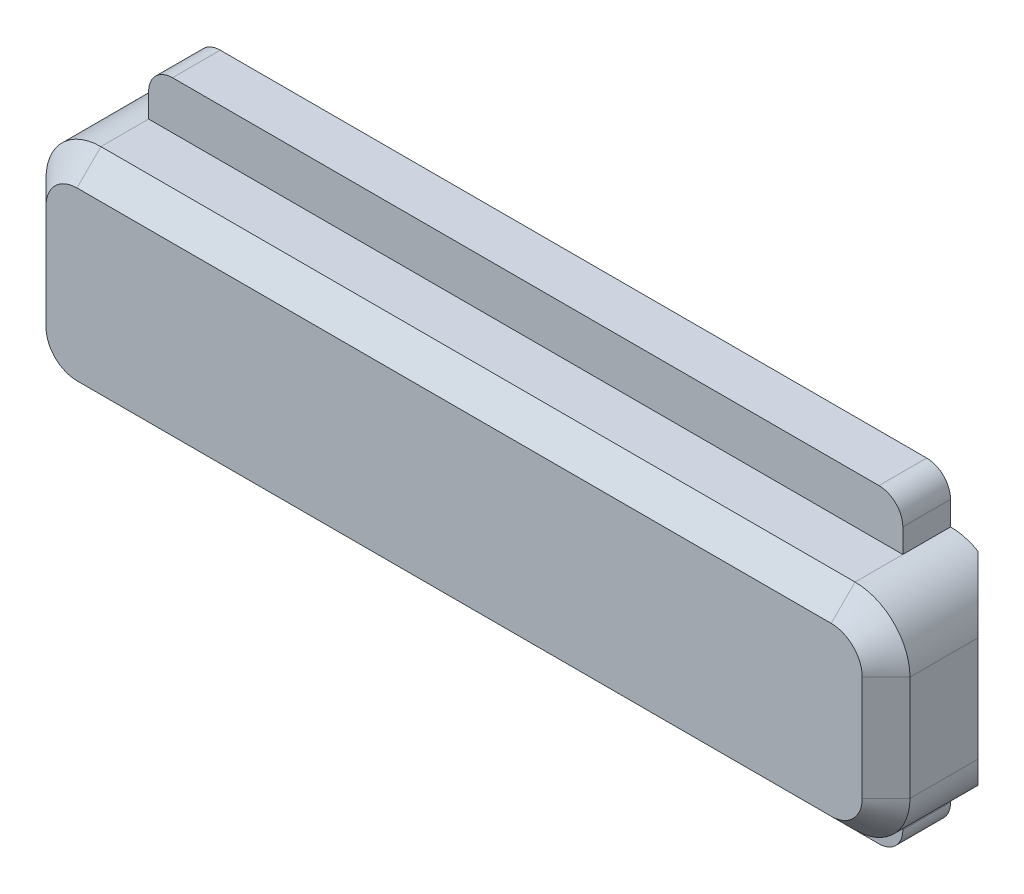
from build123d import *

# Parameters (mm, degrees)
EXTRUDE_1_DEPTH     = 2.5
SKETCH_2_W          = 15.8
SKETCH_2_H          = 6.5
EXTRUDE_2_DEPTH     = 1
FILLET_1_R          = 0.5
CHAMFER_1_SIZE      = 0.5
CUT_EXTRUDE_1_DEPTH = 12.419391402


with BuildPart() as part:
    # 草图1 → 凸台-拉伸1 (new body)
    with BuildSketch(Plane.XY):
        with BuildLine():
            Line((-9.05, -1.25), (-9.05, -3.45))
            ThreePointArc((-9.05, -3.45), (-8.713172798, -4.263172798), (-7.9, -4.6))
            Line((-7.9, -4.6), (7.9, -4.6))
            ThreePointArc((7.9, -4.6), (8.713172798, -4.263172798), (9.05, -3.45))
            Line((9.05, -3.45), (9.05, -1.25))
            ThreePointArc((9.05, -1.25), (8.713172798, -0.436827202), (7.9, -0.1))
            Line((7.9, -0.1), (-7.9, -0.1))
            ThreePointArc((-7.9, -0.1), (-8.713172798, -0.436827202), (-9.05, -1.25))
        make_face()
    extrude(amount=-EXTRUDE_1_DEPTH)

    # 草图2 → 凸台-拉伸2 (add)
    with BuildSketch(Plane(origin=(0, 0, -2.5), x_dir=(-1, 0, 0), z_dir=(0, 0, -1))):
        with Locations((0, -2.35)):
            Rectangle(SKETCH_2_W, SKETCH_2_H)
    extrude(amount=-EXTRUDE_2_DEPTH)

    # 圆角1
    fillet_1_edges = [part.edges().sort_by_distance(p)[0] for p in [
        (-7.9, 0.9, -2),
        (-7.9, -5.6, -2),
        (7.9, -5.6, -2),
        (7.9, 0.9, -2),
    ]]
    fillet(fillet_1_edges, radius=FILLET_1_R)

    # 倒角1
    chamfer_1_edges = [part.edges().sort_by_distance(p)[0] for p in [
        (-9.05, -2.35, 0),
        (-8.713172798, -0.436827202, 0),
        (0, -0.1, 0),
        (8.713172798, -0.436827202, 0),
        (9.05, -2.35, 0),
        (8.713172798, -4.263172798, 0),
        (0, -4.6, 0),
        (-8.713172798, -4.263172798, 0),
    ]]
    chamfer(chamfer_1_edges, length=CHAMFER_1_SIZE)

    # 草图3 → 切除-拉伸1 (cut, through all)
    with BuildSketch(Plane(origin=(0, 0.9, 0), x_dir=(1, 0, 0), z_dir=(0, 1, 0))):
        Polygon((8.475, 2.5), (9.05, 1.925), (9.05, 2.5), align=None)
        Polygon((-9.05, 1.925), (-9.05, 2.5), (-8.475, 2.5), align=None)
    extrude(amount=-CUT_EXTRUDE_1_DEPTH, mode=Mode.SUBTRACT)


solid = part.part
